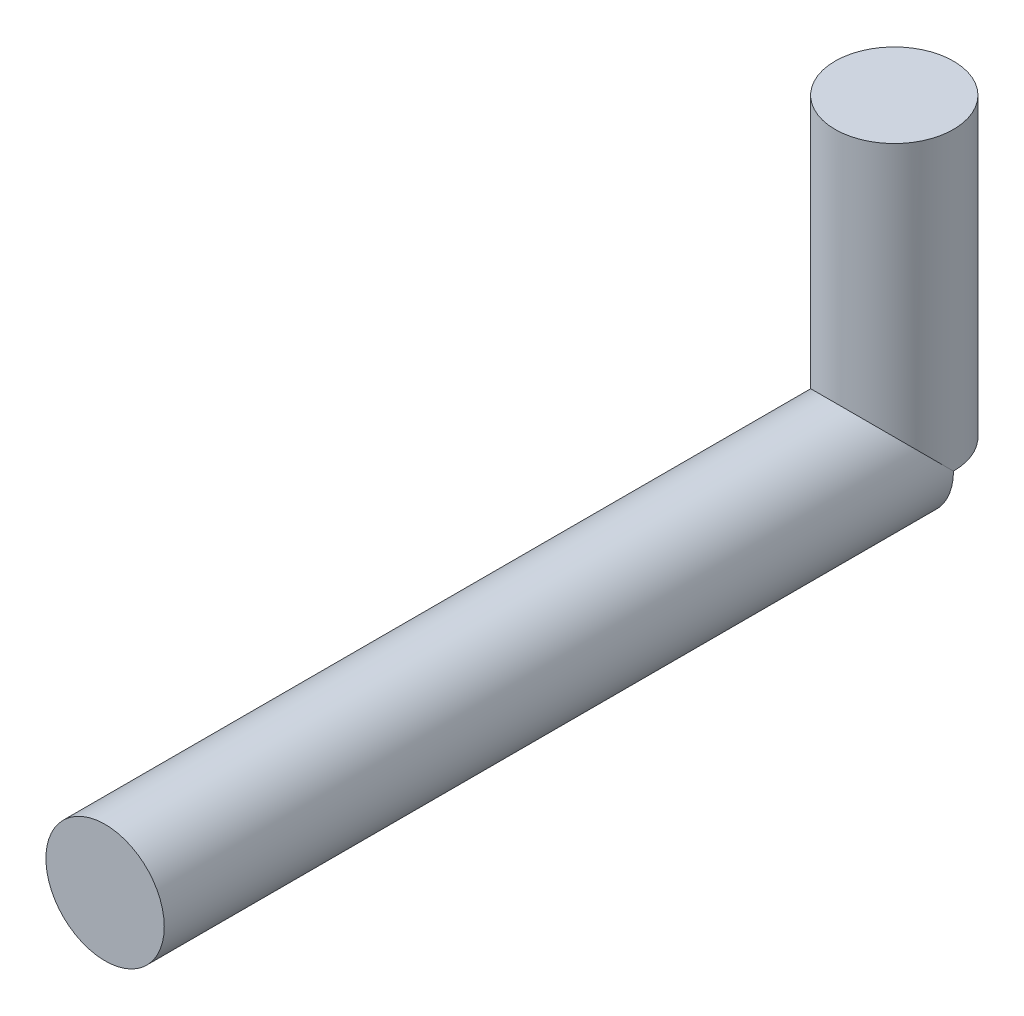
from build123d import *

# Parameters (mm, degrees)
SKETCH_1_R      = 0.3
EXTRUDE_1_DEPTH = 4
SKETCH_4_R      = 0.3
EXTRUDE_5_DEPTH = 1.5


with BuildPart() as part:
    # 草图1 → 凸台-拉伸1 (new body)
    with BuildSketch(Plane.XY):
        Circle(SKETCH_1_R)
    extrude(amount=EXTRUDE_1_DEPTH)

    # 草图4 → 凸台-拉伸5 (add)
    with BuildSketch(Plane(origin=(0, 0, 0), x_dir=(1, 0, 0), z_dir=(0, 1, 0))):
        with Locations(Location((0, 0, 0), (0, 0, 180))):
            Circle(SKETCH_4_R)
    extrude(amount=EXTRUDE_5_DEPTH)


solid = part.part
